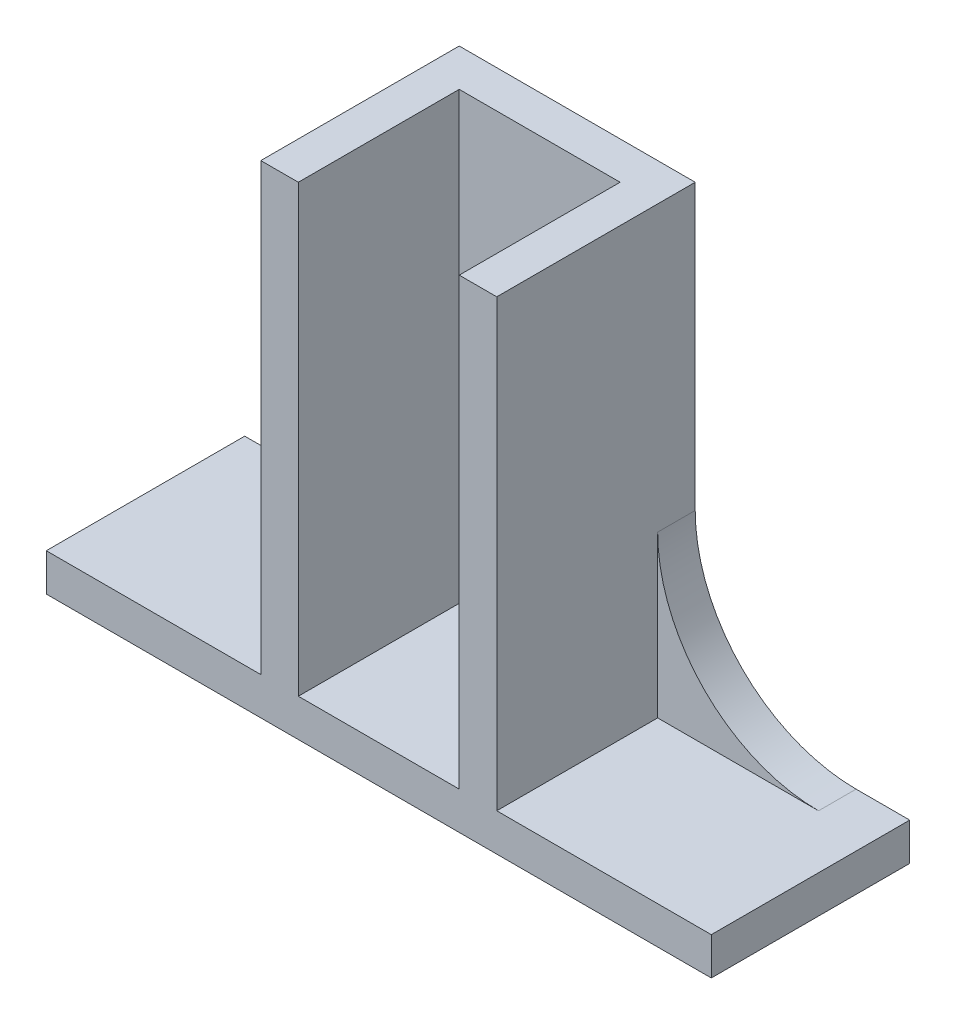
from build123d import *

# Parameters (mm, degrees)
SKETCH1_W           = 22
SKETCH1_H           = 45
BOSS_EXTRUDE1_DEPTH = 18.5
SKETCH2_W           = 15
SKETCH2_H           = 41.5
CUT_EXTRUDE1_DEPTH  = 15
SKETCH3_W           = 20
SKETCH3_H           = 3.5
BOSS_EXTRUDE2_DEPTH = 18.5
BOSS_EXTRUDE3_DEPTH = 3.5


with BuildPart() as part:
    # Sketch1 → Boss-Extrude1 (new body)
    with BuildSketch(Plane.XY):
        with Locations((-5.139289452, 22.368914656)):
            Rectangle(SKETCH1_W, SKETCH1_H)
    extrude(amount=BOSS_EXTRUDE1_DEPTH)

    # Sketch2 → Cut-Extrude1 (cut)
    with BuildSketch(Plane.XY.offset(18.5)):
        with Locations((-5.139289452, 24.118914656)):
            Rectangle(SKETCH2_W, SKETCH2_H)
    extrude(amount=-CUT_EXTRUDE1_DEPTH, mode=Mode.SUBTRACT)

    # Sketch3 → Boss-Extrude2 (add)
    with BuildSketch(Plane(origin=(0, 0, 0), x_dir=(-1, 0, 0), z_dir=(0, 0, -1))):
        with Locations((26.139289452, 1.618914656)):
            Rectangle(SKETCH3_W, SKETCH3_H)
        with Locations((-15.860710548, 1.618914656)):
            Rectangle(SKETCH3_W, SKETCH3_H)
    extrude(amount=-BOSS_EXTRUDE2_DEPTH)

    # Sketch4 → Boss-Extrude3 (add)
    with BuildSketch(Plane(origin=(0, 0, 0), x_dir=(-1, 0, 0), z_dir=(0, 0, -1))):
        with BuildLine():
            Line((31.139289452, 3.368914656), (16.139289452, 3.368914656))
            Line((16.139289452, 3.368914656), (16.139289452, 18.368914656))
            ThreePointArc((16.139289452, 18.368914656), (20.532687735, 7.762312938), (31.139289452, 3.368914656))
        make_face()
        with BuildLine():
            Line((-20.860710548, 3.368914656), (-5.860710548, 3.368914656))
            Line((-5.860710548, 3.368914656), (-5.860710548, 18.368914656))
            ThreePointArc((-5.860710548, 18.368914656), (-10.25410883, 7.762312938), (-20.860710548, 3.368914656))
        make_face()
    extrude(amount=-BOSS_EXTRUDE3_DEPTH)


solid = part.part
